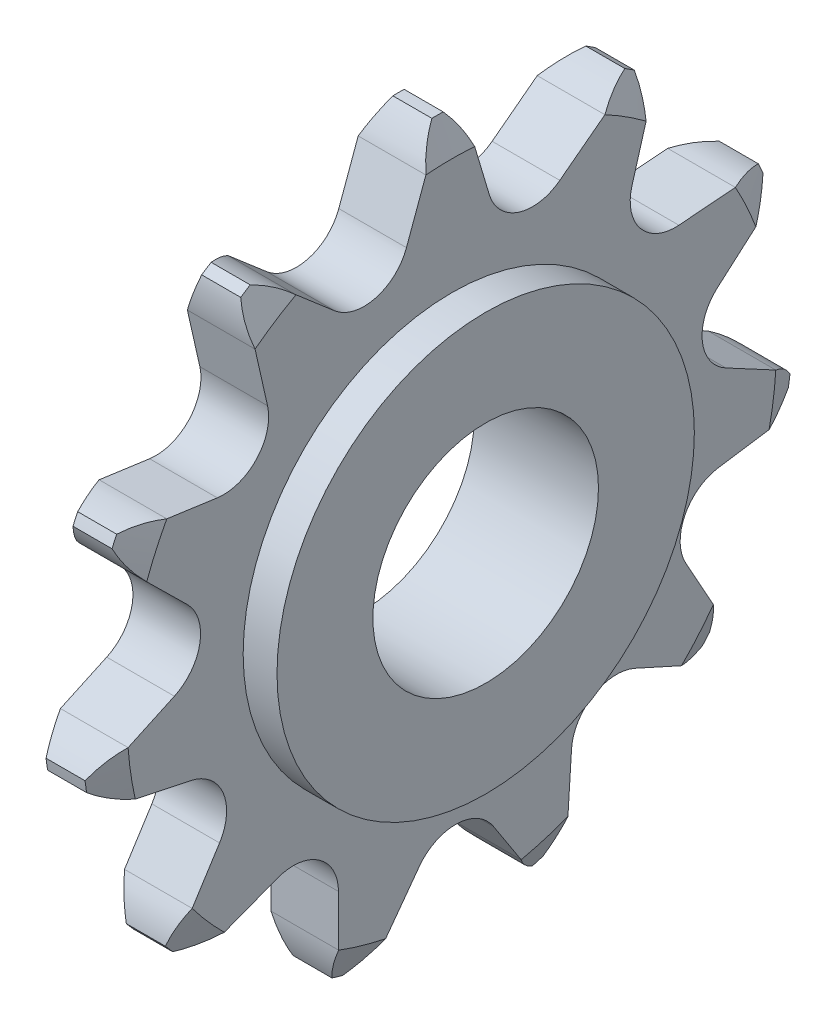
from build123d import *

# Parameters (mm, degrees)
SKETCH1_R           = 18.5
SKETCH1_R_2         = 10
BOSS_EXTRUDE1_DEPTH = 11
BOSS_EXTRUDE2_START = -6
SKETCH2_R           = 31.5
SKETCH2_R_2         = 10
BOSS_EXTRUDE2_DEPTH = 6
CHAMFER1_SIZE       = 1.27
CHAMFER1_SIZE2      = 2.723523789
CUT_EXTRUDE1_DEPTH  = 46.885727629
CIRPATTERN1_COUNT   = 11


with BuildPart() as part:
    # Sketch1 → Boss-Extrude1 (new body)
    with BuildSketch(Plane(origin=(0, 0, 0), x_dir=(0, 0, -1), z_dir=(1, 0, 0))):
        Circle(SKETCH1_R)
        Circle(SKETCH1_R_2, mode=Mode.SUBTRACT)
    extrude(amount=BOSS_EXTRUDE1_DEPTH)

    # Sketch2 → Boss-Extrude2 (add)
    with BuildSketch(Plane(origin=(7.999999904, 0, 0), x_dir=(0, 0, -1), z_dir=(1, 0, 0)).offset(BOSS_EXTRUDE2_START)):
        Circle(SKETCH2_R)
        Circle(SKETCH2_R_2, mode=Mode.SUBTRACT)
    extrude(amount=BOSS_EXTRUDE2_DEPTH)

    # Chamfer1
    chamfer1_edges = [part.edges().sort_by_distance(p)[0] for p in [
        (1.999999904, 0, 31.5),
        (7.999999904, 0, 31.5),
    ]]
    chamfer1_side = [part.faces().sort_by_distance(p)[0] for p in [
        (4.999999904, 0, 31.5),
    ]]
    chamfer(chamfer1_edges, length=CHAMFER1_SIZE, length2=CHAMFER1_SIZE2, reference=chamfer1_side[0])

    # Sketch3 → Cut-Extrude1 (cut, through all)
    with BuildSketch(Plane(origin=(11, 0, 0), x_dir=(0, 0, -1), z_dir=(1, 0, 0))):
        with BuildLine():
            Line((2.025004531, 28.705137864), (3.316836887, 24.373931538))
            ThreePointArc((3.316836887, 24.373931538), (5.909643301, 21.714368856), (9.571916138, 22.33378505))
            Line((9.571916138, 22.33378505), (13.570357606, 25.375795112))
            ThreePointArc((13.570357606, 25.375795112), (15.011752501, 26.239592723), (16.607426831, 26.766459872))
            ThreePointArc((16.607426831, 26.766459872), (16.819336008, 26.633811898), (17.03018575, 26.499486284))
            Line((17.03018575, 26.499486284), (18.753086107, 29.492558003))
            Line((18.753086107, 29.492558003), (0, 32.610896361))
            Line((0, 32.610896361), (0, 31.5))
            ThreePointArc((0, 31.5), (0.250007874, 31.499007858), (0.5, 31.496031496))
            ThreePointArc((0.5, 31.496031496), (1.409727709, 30.18103184), (2.025004531, 28.705137864))
        make_face()
    cut_extrude1 = extrude(amount=-CUT_EXTRUDE1_DEPTH, mode=Mode.SUBTRACT)

    # CirPattern1: Cut-Extrude1 ×11 about axis
    cirpattern1_axis = Axis((11, 0, 0), (-1, 0, 0))
    for i in range(1, CIRPATTERN1_COUNT):
        add(cut_extrude1.rotate(cirpattern1_axis, i * 360 / CIRPATTERN1_COUNT), mode=Mode.SUBTRACT)


solid = part.part
